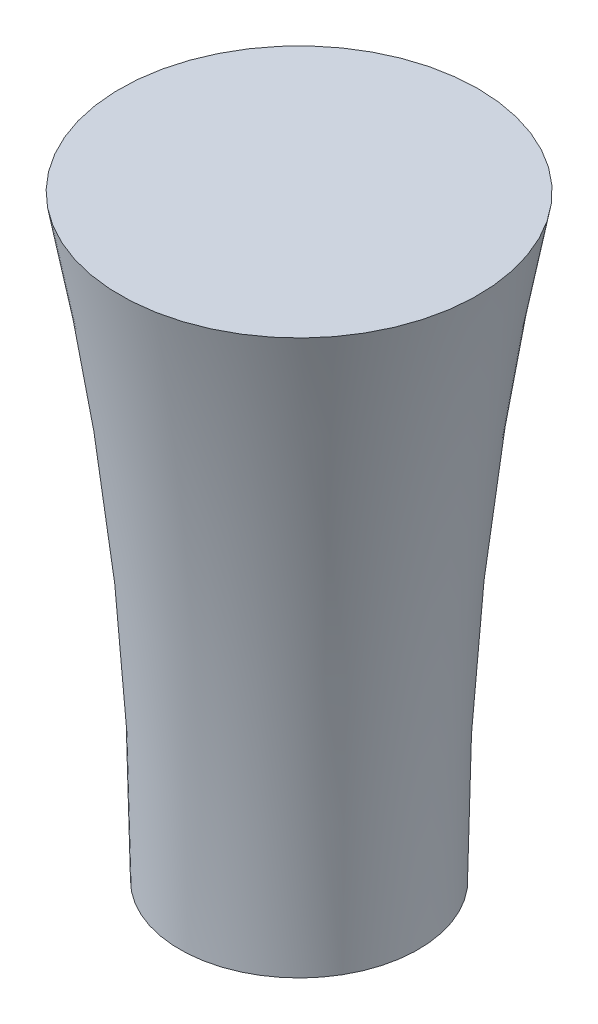
from build123d import *


with BuildPart() as part:
    # Sketch4 → Revolve1 (revolve)
    with BuildSketch(Plane.XY):
        with BuildLine():
            Line((0, 0), (0, 5))
            Line((0, 5), (1.5, 5))
            ThreePointArc((1.5, 5), (1.125310947, 2.512468905), (1, 0))
            Line((1, 0), (0, 0))
        make_face()
    revolve(axis=Axis((0, 0, 0), (0, 1, 0)))


solid = part.part
